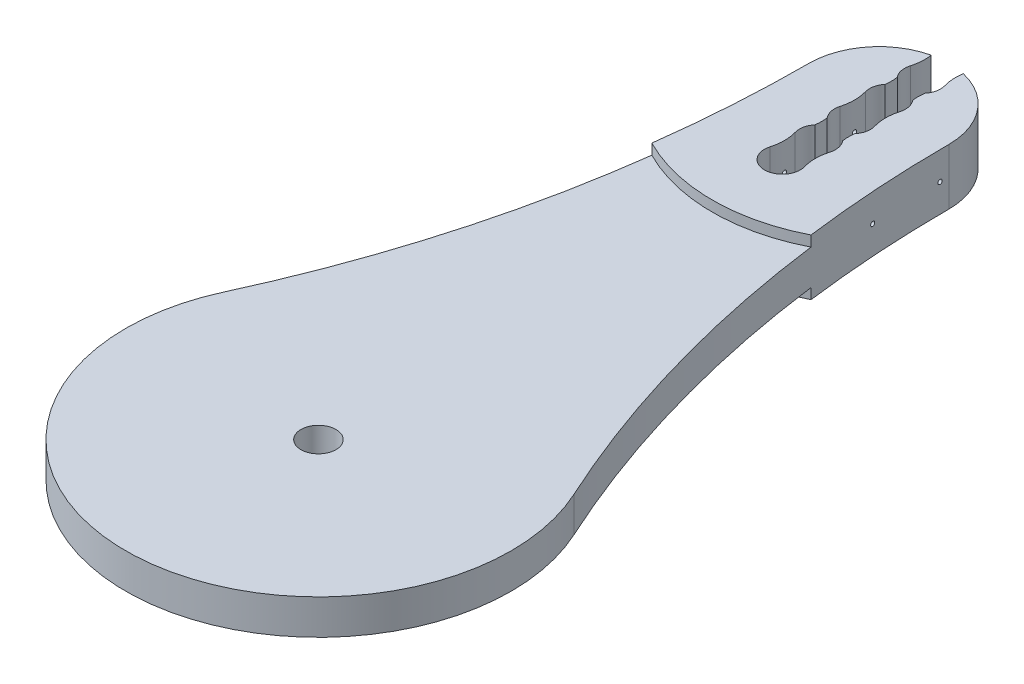
from build123d import *

# Parameters (mm, degrees)
SKETCH1_R               = 3.175
BOSS_EXTRUDE1_DEPTH     = 5.08
CUT_EXTRUDE2_DEPTH      = 5.715
CUT_EXTRUDE3_DEPTH      = 120.302535254
CUT_EXTRUDE3_DEPTH_BACK = 120.302535254
SKETCH4_R               = 0.396875
CUT_EXTRUDE8_DEPTH      = 1.905


with BuildPart() as part:
    # Sketch1 → Boss-Extrude1 (new, symmetric)
    with BuildSketch(Plane(origin=(0, 0, 0), x_dir=(1, 0, 0), z_dir=(0, 1, 0))):
        with BuildLine():
            ThreePointArc((-12.7, 101.6), (-17.514407624, 57.062136043), (-31.735205033, 14.581919851))
            ThreePointArc((-31.735205033, 14.581919851), (0, -34.925), (31.735205033, 14.581919851))
            ThreePointArc((31.735205033, 14.581919851), (17.514407624, 57.062136043), (12.7, 101.6))
            ThreePointArc((12.7, 101.6), (0, 114.3), (-12.7, 101.6))
        make_face()
        with Locations(Location((0, 0, 0), (0, 0, 270))):
            Circle(SKETCH1_R, mode=Mode.SUBTRACT)
    extrude(amount=BOSS_EXTRUDE1_DEPTH, both=True)

    # Sketch2 → Cut-Extrude2 (cut, symmetric)
    with BuildSketch(Plane(origin=(0, 0, 0), x_dir=(1, 0, 0), z_dir=(0, 1, 0))):
        with BuildLine():
            ThreePointArc((-2.500603456, 105.207450456), (-2.42672892, 106.304643007), (-2.500603456, 107.401835557))
            ThreePointArc((-2.500603456, 107.401835557), (-3.18246494, 108.814648011), (-3.123385981, 110.382284382))
            ThreePointArc((-3.123385981, 110.382284382), (-2.80162, 112.654643007), (-3.123385981, 114.927001632))
            ThreePointArc((-3.123385981, 114.927001632), (-3.18246494, 116.494638003), (-2.500603456, 117.907450456))
            ThreePointArc((-2.500603456, 117.907450456), (-2.42672892, 119.004643007), (-2.500603456, 120.101835557))
            ThreePointArc((-2.500603456, 120.101835557), (-3.18246494, 121.514648011), (-3.123385981, 123.082284382))
            ThreePointArc((-3.123385981, 123.082284382), (-2.80162, 125.354643007), (-3.123385981, 127.627001632))
            ThreePointArc((-3.123385981, 127.627001632), (-3.18246494, 129.194638003), (-2.500603456, 130.607450456))
            ThreePointArc((-2.500603456, 130.607450456), (-2.451700025, 132.343502027), (-2.77019509, 134.050788615))
            ThreePointArc((-2.77019509, 134.050788615), (0, 137.771179007), (2.77019509, 134.050788615))
            ThreePointArc((2.77019509, 134.050788615), (2.451700025, 132.343502027), (2.500603456, 130.607450456))
            ThreePointArc((2.500603456, 130.607450456), (3.18246494, 129.194638003), (3.123385981, 127.627001632))
            ThreePointArc((3.123385981, 127.627001632), (2.80162, 125.354643007), (3.123385981, 123.082284382))
            ThreePointArc((3.123385981, 123.082284382), (3.18246494, 121.514648011), (2.500603456, 120.101835557))
            ThreePointArc((2.500603456, 120.101835557), (2.42672892, 119.004643007), (2.500603456, 117.907450456))
            ThreePointArc((2.500603456, 117.907450456), (3.18246494, 116.494638003), (3.123385981, 114.927001632))
            ThreePointArc((3.123385981, 114.927001632), (2.80162, 112.654643007), (3.123385981, 110.382284382))
            ThreePointArc((3.123385981, 110.382284382), (3.18246494, 108.814648011), (2.500603456, 107.401835557))
            ThreePointArc((2.500603456, 107.401835557), (2.42672892, 106.304643007), (2.500603456, 105.207450456))
            ThreePointArc((2.500603456, 105.207450456), (3.18246494, 103.794638003), (3.123385981, 102.227001632))
            ThreePointArc((3.123385981, 102.227001632), (2.80162, 99.954643007), (3.123385981, 97.682284382))
            ThreePointArc((3.123385981, 97.682284382), (3.18246494, 96.114648011), (2.500603456, 94.701835557))
            ThreePointArc((2.500603456, 94.701835557), (2.42672892, 93.604643007), (2.500603456, 92.507450456))
            ThreePointArc((2.500603456, 92.507450456), (3.18246494, 91.094638003), (3.123385981, 89.527001632))
            ThreePointArc((3.123385981, 89.527001632), (2.80162, 87.254643007), (3.123385981, 84.982284382))
            ThreePointArc((3.123385981, 84.982284382), (0, 80.828443007), (-3.123385981, 84.982284382))
            ThreePointArc((-3.123385981, 84.982284382), (-2.80162, 87.254643007), (-3.123385981, 89.527001632))
            ThreePointArc((-3.123385981, 89.527001632), (-3.18246494, 91.094638003), (-2.500603456, 92.507450456))
            ThreePointArc((-2.500603456, 92.507450456), (-2.42672892, 93.604643007), (-2.500603456, 94.701835557))
            ThreePointArc((-2.500603456, 94.701835557), (-3.18246494, 96.114648011), (-3.123385981, 97.682284382))
            ThreePointArc((-3.123385981, 97.682284382), (-2.80162, 99.954643007), (-3.123385981, 102.227001632))
            ThreePointArc((-3.123385981, 102.227001632), (-3.18246494, 103.794638003), (-2.500603456, 105.207450456))
        make_face()
    extrude(amount=CUT_EXTRUDE2_DEPTH, both=True, mode=Mode.SUBTRACT)

    # Sketch4 → Cut-Extrude3 (cut, two sides: drawn at the far end of the back side and taken through both)
    with BuildSketch(Plane(origin=(0, 0, 0), x_dir=(0, 0, -1), z_dir=(1, 0, 0)).offset(-CUT_EXTRUDE3_DEPTH_BACK)):
        with Locations((87.254643007, 0)):
            Circle(SKETCH4_R)
        with Locations((99.954643007, 0)):
            Circle(SKETCH4_R)
    extrude(amount=CUT_EXTRUDE3_DEPTH + CUT_EXTRUDE3_DEPTH_BACK, mode=Mode.SUBTRACT)

    # Sketch11 → Cut-Extrude8 (cut)
    with BuildSketch(Plane(origin=(0, 5.08, 0), x_dir=(1, 0, 0), z_dir=(0, 1, 0))):
        with BuildLine():
            Line((-34.908444977, 1.075218257), (-31.734949979, 104.107114149))
            ThreePointArc((-31.734949979, 104.107114149), (0, 71.379643007), (31.734949979, 104.107114149))
            Line((31.734949979, 104.107114149), (34.908444977, 1.075218257))
            ThreePointArc((34.908444977, 1.075218257), (0, -34.925), (-34.908444977, 1.075218257))
        make_face()
    cut_extrude8 = extrude(amount=-CUT_EXTRUDE8_DEPTH, mode=Mode.SUBTRACT)

    # Mirror1: Cut-Extrude8 across plane
    add(cut_extrude8.mirror(Plane.ZX), mode=Mode.SUBTRACT)


solid = part.part
